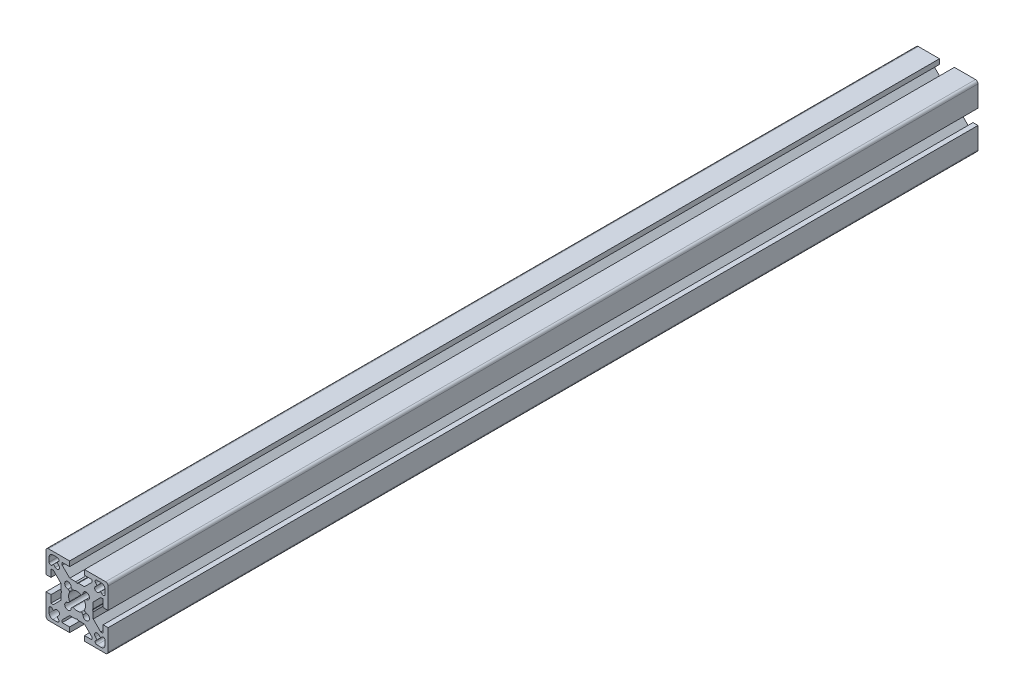
from build123d import *

# Parameters (mm, degrees)
BOSS_EXTRUDE1_DEPTH = 350


with BuildPart() as part:
    # Sketch1 → Boss-Extrude1 (new body)
    with BuildSketch(Plane(origin=(0, 0, -350), x_dir=(-1, 0, 0), z_dir=(0, 0, -1))):
        with BuildLine():
            Line((12.5, -3), (10.5, -3))
            Line((10.5, -3), (10.5, -6))
            Line((10.5, -6), (9.535533906, -6))
            Line((9.535533906, -6), (6.5, -2.964466094))
            Line((6.5, -2.964466094), (6.5, -0.519615242))
            Line((6.5, -0.519615242), (6.2, 0))
            Line((6.2, 0), (6.5, 0.519615242))
            Line((6.5, 0.519615242), (6.5, 2.964466094))
            Line((6.5, 2.964466094), (9.535533906, 6))
            Line((9.535533906, 6), (10.5, 6))
            Line((10.5, 6), (10.5, 3))
            Line((10.5, 3), (12.5, 3))
            Line((12.5, 3), (12.5, 11.5))
            ThreePointArc((12.5, 11.5), (12.207106781, 12.207106781), (11.5, 12.5))
            Line((11.5, 12.5), (3, 12.5))
            Line((3, 12.5), (3, 10.5))
            Line((3, 10.5), (6, 10.5))
            Line((6, 10.5), (6, 9.535533906))
            Line((6, 9.535533906), (2.964466094, 6.5))
            Line((2.964466094, 6.5), (0.519615242, 6.5))
            Line((0.519615242, 6.5), (0, 6.2))
            Line((0, 6.2), (-0.519615242, 6.5))
            Line((-0.519615242, 6.5), (-2.964466094, 6.5))
            Line((-2.964466094, 6.5), (-6, 9.535533906))
            Line((-6, 9.535533906), (-6, 10.5))
            Line((-6, 10.5), (-3, 10.5))
            Line((-3, 10.5), (-3, 12.5))
            Line((-3, 12.5), (-11.5, 12.5))
            ThreePointArc((-11.5, 12.5), (-12.207106781, 12.207106781), (-12.5, 11.5))
            Line((-12.5, 11.5), (-12.5, 3))
            Line((-12.5, 3), (-10.5, 3))
            Line((-10.5, 3), (-10.5, 6))
            Line((-10.5, 6), (-9.535533906, 6))
            Line((-9.535533906, 6), (-6.5, 2.964466094))
            Line((-6.5, 2.964466094), (-6.5, 0.519615242))
            Line((-6.5, 0.519615242), (-6.2, 0))
            Line((-6.2, 0), (-6.5, -0.519615242))
            Line((-6.5, -0.519615242), (-6.5, -2.964466094))
            Line((-6.5, -2.964466094), (-9.535533906, -6))
            Line((-9.535533906, -6), (-10.5, -6))
            Line((-10.5, -6), (-10.5, -3))
            Line((-10.5, -3), (-12.5, -3))
            Line((-12.5, -3), (-12.5, -11.5))
            ThreePointArc((-12.5, -11.5), (-12.207106781, -12.207106781), (-11.5, -12.5))
            Line((-11.5, -12.5), (-3, -12.5))
            Line((-3, -12.5), (-3, -10.5))
            Line((-3, -10.5), (-6, -10.5))
            Line((-6, -10.5), (-6, -9.535533906))
            Line((-6, -9.535533906), (-2.964466094, -6.5))
            Line((-2.964466094, -6.5), (-0.519615242, -6.5))
            Line((-0.519615242, -6.5), (0, -6.2))
            Line((0, -6.2), (0.519615242, -6.5))
            Line((0.519615242, -6.5), (2.964466094, -6.5))
            Line((2.964466094, -6.5), (6, -9.535533906))
            Line((6, -9.535533906), (6, -10.5))
            Line((6, -10.5), (3, -10.5))
            Line((3, -10.5), (3, -12.5))
            Line((3, -12.5), (11.5, -12.5))
            ThreePointArc((11.5, -12.5), (12.207106781, -12.207106781), (12.5, -11.5))
            Line((12.5, -11.5), (12.5, -3))
        make_face()
        with BuildLine():
            Line((3.087755464, -1.885673936), (3.585519377, -2.383437849))
            ThreePointArc((3.585519377, -2.383437849), (4.599238816, -4.599238816), (2.383437849, -3.585519377))
            Line((2.383437849, -3.585519377), (1.885673936, -3.087755464))
            ThreePointArc((1.885673936, -3.087755464), (1.720751743, -3.0036254), (1.537849315, -3.032329053))
            ThreePointArc((1.537849315, -3.032329053), (0, -3.4), (-1.537849315, -3.032329053))
            ThreePointArc((-1.537849315, -3.032329053), (-1.720751743, -3.0036254), (-1.885673936, -3.087755464))
            Line((-1.885673936, -3.087755464), (-2.383437849, -3.585519377))
            ThreePointArc((-2.383437849, -3.585519377), (-4.599238816, -4.599238816), (-3.585519377, -2.383437849))
            Line((-3.585519377, -2.383437849), (-3.087755464, -1.885673936))
            ThreePointArc((-3.087755464, -1.885673936), (-3.0036254, -1.720751743), (-3.032329053, -1.537849315))
            ThreePointArc((-3.032329053, -1.537849315), (-3.4, 0), (-3.032329053, 1.537849315))
            ThreePointArc((-3.032329053, 1.537849315), (-3.0036254, 1.720751743), (-3.087755464, 1.885673936))
            Line((-3.087755464, 1.885673936), (-3.585519377, 2.383437849))
            ThreePointArc((-3.585519377, 2.383437849), (-4.599238816, 4.599238816), (-2.383437849, 3.585519377))
            Line((-2.383437849, 3.585519377), (-1.885673936, 3.087755464))
            ThreePointArc((-1.885673936, 3.087755464), (-1.720751743, 3.0036254), (-1.537849315, 3.032329053))
            ThreePointArc((-1.537849315, 3.032329053), (0, 3.4), (1.537849315, 3.032329053))
            ThreePointArc((1.537849315, 3.032329053), (1.720751743, 3.0036254), (1.885673936, 3.087755464))
            Line((1.885673936, 3.087755464), (2.383437849, 3.585519377))
            ThreePointArc((2.383437849, 3.585519377), (4.599238816, 4.599238816), (3.585519377, 2.383437849))
            Line((3.585519377, 2.383437849), (3.087755464, 1.885673936))
            ThreePointArc((3.087755464, 1.885673936), (3.0036254, 1.720751743), (3.032329053, 1.537849315))
            ThreePointArc((3.032329053, 1.537849315), (3.4, 0), (3.032329053, -1.537849315))
            ThreePointArc((3.032329053, -1.537849315), (3.0036254, -1.720751743), (3.087755464, -1.885673936))
        make_face(mode=Mode.SUBTRACT)
        with BuildLine():
            Line((11.25, -7.976197667), (11.25, -9.75))
            ThreePointArc((11.25, -9.75), (10.810660172, -10.810660172), (9.75, -11.25))
            Line((9.75, -11.25), (7.976197667, -11.25))
            ThreePointArc((7.976197667, -11.25), (7.329481994, -10.817878403), (7.48122292, -10.055025253))
            Line((7.48122292, -10.055025253), (8.061017306, -9.475230868))
            Line((8.061017306, -9.475230868), (7.353910524, -8.768124087))
            ThreePointArc((7.353910524, -8.768124087), (7.353910524, -7.353910524), (8.768124087, -7.353910524))
            Line((8.768124087, -7.353910524), (9.475230868, -8.061017306))
            Line((9.475230868, -8.061017306), (10.055025253, -7.48122292))
            ThreePointArc((10.055025253, -7.48122292), (10.817878403, -7.329481994), (11.25, -7.976197667))
        make_face(mode=Mode.SUBTRACT)
        with BuildLine():
            Line((-8.061017306, 9.475230868), (-7.353910524, 8.768124087))
            ThreePointArc((-7.353910524, 8.768124087), (-7.353910524, 7.353910524), (-8.768124087, 7.353910524))
            Line((-8.768124087, 7.353910524), (-9.475230868, 8.061017306))
            Line((-9.475230868, 8.061017306), (-10.055025253, 7.48122292))
            ThreePointArc((-10.055025253, 7.48122292), (-10.817878403, 7.329481994), (-11.25, 7.976197667))
            Line((-11.25, 7.976197667), (-11.25, 9.75))
            ThreePointArc((-11.25, 9.75), (-10.810660172, 10.810660172), (-9.75, 11.25))
            Line((-9.75, 11.25), (-7.976197667, 11.25))
            ThreePointArc((-7.976197667, 11.25), (-7.329481994, 10.817878403), (-7.48122292, 10.055025253))
            Line((-7.48122292, 10.055025253), (-8.061017306, 9.475230868))
        make_face(mode=Mode.SUBTRACT)
        with BuildLine():
            Line((-9.475230868, -8.061017306), (-8.768124087, -7.353910524))
            ThreePointArc((-8.768124087, -7.353910524), (-7.353910524, -7.353910524), (-7.353910524, -8.768124087))
            Line((-7.353910524, -8.768124087), (-8.061017306, -9.475230868))
            Line((-8.061017306, -9.475230868), (-7.48122292, -10.055025253))
            ThreePointArc((-7.48122292, -10.055025253), (-7.329481994, -10.817878403), (-7.976197667, -11.25))
            Line((-7.976197667, -11.25), (-9.75, -11.25))
            ThreePointArc((-9.75, -11.25), (-10.810660172, -10.810660172), (-11.25, -9.75))
            Line((-11.25, -9.75), (-11.25, -7.976197667))
            ThreePointArc((-11.25, -7.976197667), (-10.817878403, -7.329481994), (-10.055025253, -7.48122292))
            Line((-10.055025253, -7.48122292), (-9.475230868, -8.061017306))
        make_face(mode=Mode.SUBTRACT)
        with BuildLine():
            Line((11.25, 9.75), (11.25, 7.976197667))
            ThreePointArc((11.25, 7.976197667), (10.817878403, 7.329481994), (10.055025253, 7.48122292))
            Line((10.055025253, 7.48122292), (9.475230868, 8.061017306))
            Line((9.475230868, 8.061017306), (8.768124087, 7.353910524))
            ThreePointArc((8.768124087, 7.353910524), (7.353910524, 7.353910524), (7.353910524, 8.768124087))
            Line((7.353910524, 8.768124087), (8.061017306, 9.475230868))
            Line((8.061017306, 9.475230868), (7.48122292, 10.055025253))
            ThreePointArc((7.48122292, 10.055025253), (7.329481994, 10.817878403), (7.976197667, 11.25))
            Line((7.976197667, 11.25), (9.75, 11.25))
            ThreePointArc((9.75, 11.25), (10.810660172, 10.810660172), (11.25, 9.75))
        make_face(mode=Mode.SUBTRACT)
    extrude(amount=-BOSS_EXTRUDE1_DEPTH)


solid = part.part
